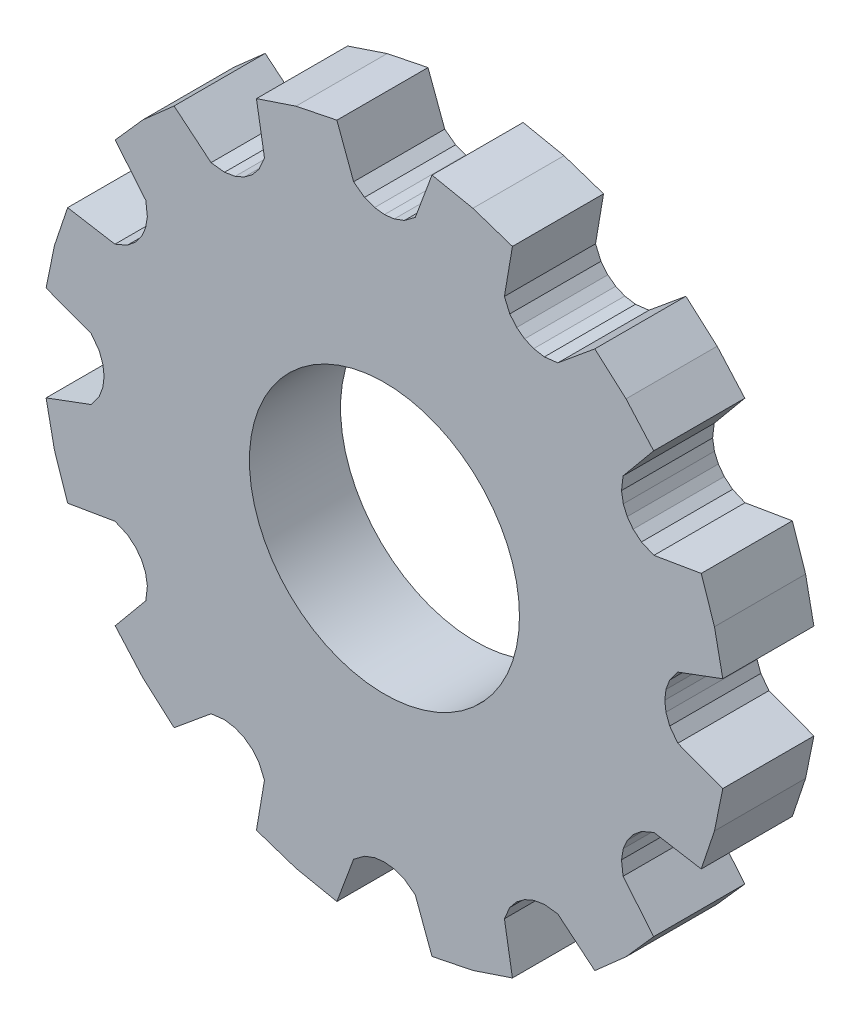
from build123d import *

# Parameters (mm, degrees)
ROLLER_SEATING_TOOTH_PROFILE_DEPTH = 5.5
SKETCH_2_R                         = 8.15
THROUGH_SHAFT_BORE_DEPTH           = 30.398963933


with BuildPart() as part:
    # 草图1 → Roller_seating_tooth_profile (new body)
    with BuildSketch(Plane.XY):
        Polygon((19.919196173, -5.337332529), (20.421178717, -2.870009502), (17.706188737, -1.860995427), (17.217421057, -1.203959364), (16.990472298, -0.593320367), (16.921869331, 0), (16.990472298, 0.593320367), (17.217421057, 1.203959364), (17.706188737, 1.860995427), (20.421178717, 2.870009502), (19.919196173, 5.337332529), (19.120264295, 7.72508822), (16.264506963, 7.241425053), (15.512703705, 7.566051134), (15.010840815, 7.981405639), (14.65476872, 8.460934666), (14.417520449, 9.009066659), (14.308744341, 9.651369923), (14.403511537, 10.464763684), (16.250254793, 12.696090496), (14.581863645, 14.581863645), (12.696090496, 16.250254793), (10.464763684, 14.403511537), (9.651369923, 14.308744341), (9.009066659, 14.417520449), (8.460934666, 14.65476872), (7.981405639, 15.010840815), (7.566051134, 15.512703705), (7.241425053, 16.264506963), (7.72508822, 19.120264295), (5.337332529, 19.919196173), (2.870009502, 20.421178717), (1.860995427, 17.706188737), (1.203959364, 17.217421057), (0.593320367, 16.990472298), (0, 16.921869331), (-0.593320367, 16.990472298), (-1.203959364, 17.217421057), (-1.860995427, 17.706188737), (-2.870009502, 20.421178717), (-5.337332529, 19.919196173), (-7.72508822, 19.120264295), (-7.241425053, 16.264506963), (-7.566051134, 15.512703705), (-7.981405639, 15.010840815), (-8.460934666, 14.65476872), (-9.009066659, 14.417520449), (-9.651369923, 14.308744341), (-10.464763684, 14.403511537), (-12.696090496, 16.250254793), (-14.581863645, 14.581863645), (-16.250254793, 12.696090496), (-14.403511537, 10.464763684), (-14.308744341, 9.651369923), (-14.417520449, 9.009066659), (-14.65476872, 8.460934666), (-15.010840815, 7.981405639), (-15.512703705, 7.566051134), (-16.264506963, 7.241425053), (-19.120264295, 7.72508822), (-19.919196173, 5.337332529), (-20.421178717, 2.870009502), (-17.706188737, 1.860995427), (-17.217421057, 1.203959364), (-16.990472298, 0.593320367), (-16.921869331, 0), (-16.990472298, -0.593320367), (-17.217421057, -1.203959364), (-17.706188737, -1.860995427), (-20.421178717, -2.870009502), (-19.919196173, -5.337332529), (-19.120264295, -7.72508822), (-16.264506963, -7.241425053), (-15.512703705, -7.566051134), (-15.010840815, -7.981405639), (-14.65476872, -8.460934666), (-14.417520449, -9.009066659), (-14.308744341, -9.651369923), (-14.403511537, -10.464763684), (-16.250254793, -12.696090496), (-14.581863645, -14.581863645), (-12.696090496, -16.250254793), (-10.464763684, -14.403511537), (-9.651369923, -14.308744341), (-9.009066659, -14.417520449), (-8.460934666, -14.65476872), (-7.981405639, -15.010840815), (-7.566051134, -15.512703705), (-7.241425053, -16.264506963), (-7.72508822, -19.120264295), (-5.337332529, -19.919196173), (-2.870009502, -20.421178717), (-1.860995427, -17.706188737), (-1.203959364, -17.217421057), (-0.593320367, -16.990472298), (0, -16.921869331), (0.593320367, -16.990472298), (1.203959364, -17.217421057), (1.860995427, -17.706188737), (2.870009502, -20.421178717), (5.337332529, -19.919196173), (7.72508822, -19.120264295), (7.241425053, -16.264506963), (7.566051134, -15.512703705), (7.981405639, -15.010840815), (8.460934666, -14.65476872), (9.009066659, -14.417520449), (9.651369923, -14.308744341), (10.464763684, -14.403511537), (12.696090496, -16.250254793), (14.581863645, -14.581863645), (16.250254793, -12.696090496), (14.403511537, -10.464763684), (14.308744341, -9.651369923), (14.417520449, -9.009066659), (14.65476872, -8.460934666), (15.010840815, -7.981405639), (15.512703705, -7.566051134), (16.264506963, -7.241425053), (19.120264295, -7.72508822), align=None)
    extrude(amount=ROLLER_SEATING_TOOTH_PROFILE_DEPTH)

    # 草图2 → Through_shaft_bore (cut, through all)
    with BuildSketch(Plane.XY.offset(5.5)):
        Circle(SKETCH_2_R)
    extrude(amount=-THROUGH_SHAFT_BORE_DEPTH, mode=Mode.SUBTRACT)


solid = part.part
